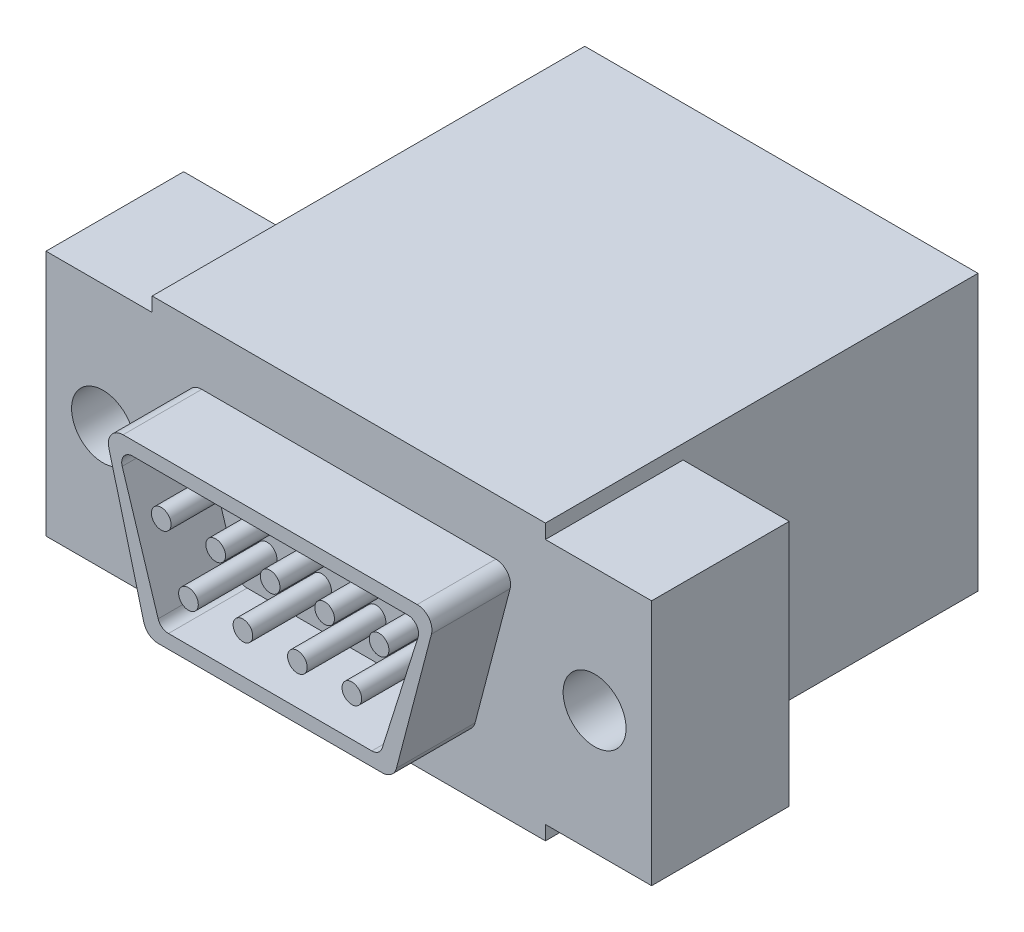
from build123d import *

# Parameters (mm, degrees)
SKETCH_1_W                                     = 30.8
SKETCH_1_H                                     = 12.55
M3_01_THINFLANGE_30_80X12_55X0_60_DEPTH        = 0.6
SKETCH_2_W                                     = 30.8
SKETCH_2_H                                     = 12.55
M3_02_FIRSTSHOULDER_30_80X12_55_D7_00_DEPTH    = 7
SKETCH_3_W                                     = 20
SKETCH_3_H                                     = 14
M3_03_SECONDSTAGECORE_20_00X14_00_D22_00_DEPTH = 22
SKETCH_4_R                                     = 2.5
M3_04_SIMPLIFIEDFIXEDPOSTS_DIA5_00_L3_50_DEPTH = 3.5
M3_05_ROUNDEDDGUIDE_OUTERBOSS_L4_00_DEPTH      = 4
M3_06_ROUNDEDDGUIDE_INNEROPENING_DEPTH         = 4
SKETCH_7_R                                     = 0.5
M3_07_9PINS_DIA1_00_L4_00_DEPTH                = 4
SKETCH_8_R                                     = 1.6
M3_08_FIXEDPOSTBORES_DIA3_20_PITCH25_00_DEPTH  = 4


with BuildPart() as part:
    # 草图1 → M3_01_ThinFlange_30.80x12.55x0.60 (new body)
    with BuildSketch(Plane.XY):
        Rectangle(SKETCH_1_W, SKETCH_1_H)
    extrude(amount=-M3_01_THINFLANGE_30_80X12_55X0_60_DEPTH)

    # 草图2 → M3_02_FirstShoulder_30.80x12.55_D7.00 (add)
    with BuildSketch(Plane.XY):
        Rectangle(SKETCH_2_W, SKETCH_2_H)
    extrude(amount=-M3_02_FIRSTSHOULDER_30_80X12_55_D7_00_DEPTH)

    # 草图3 → M3_03_SecondStageCore_20.00x14.00_D22.00_FromFlange (add)
    with BuildSketch(Plane.XY):
        Rectangle(SKETCH_3_W, SKETCH_3_H)
    extrude(amount=-M3_03_SECONDSTAGECORE_20_00X14_00_D22_00_DEPTH)

    # 草图4 → M3_04_SimplifiedFixedPosts_Dia5.00_L3.50 (add)
    with BuildSketch(Plane.XY):
        with Locations((-12.5, 0)):
            Circle(SKETCH_4_R)
        with Locations((12.5, 0)):
            Circle(SKETCH_4_R)
    extrude(amount=-M3_04_SIMPLIFIEDFIXEDPOSTS_DIA5_00_L3_50_DEPTH)

    # 草图5 → M3_05_RoundedDGuide_OuterBoss_L4.00 (add)
    with BuildSketch(Plane.XY):
        with BuildLine():
            Line((-7.478140403, 4.15), (7.478140403, 4.15))
            ThreePointArc((7.478140403, 4.15), (8.071894431, 3.858209727), (8.20364406, 3.209883078))
            Line((8.20364406, 3.209883078), (6.421716349, -3.590116922))
            ThreePointArc((6.421716349, -3.590116922), (6.154422419, -3.993754028), (5.696212692, -4.15))
            Line((5.696212692, -4.15), (-5.696212692, -4.15))
            ThreePointArc((-5.696212692, -4.15), (-6.154422419, -3.993754028), (-6.421716349, -3.590116922))
            Line((-6.421716349, -3.590116922), (-8.20364406, 3.209883078))
            ThreePointArc((-8.20364406, 3.209883078), (-8.071894431, 3.858209727), (-7.478140403, 4.15))
        make_face()
    extrude(amount=M3_05_ROUNDEDDGUIDE_OUTERBOSS_L4_00_DEPTH)

    # 草图6 → M3_06_RoundedDGuide_InnerOpening (cut)
    with BuildSketch(Plane.XY):
        with BuildLine():
            Line((-6.999952877, 3.45), (6.999952877, 3.45))
            ThreePointArc((6.999952877, 3.45), (7.443485369, 3.225236726), (7.524509443, 2.734650647))
            Line((7.524509443, 2.734650647), (5.696248574, -3.065349353))
            ThreePointArc((5.696248574, -3.065349353), (5.496928733, -3.343532493), (5.171692007, -3.45))
            Line((5.171692007, -3.45), (-5.171692007, -3.45))
            ThreePointArc((-5.171692007, -3.45), (-5.496928733, -3.343532493), (-5.696248574, -3.065349353))
            Line((-5.696248574, -3.065349353), (-7.524509443, 2.734650647))
            ThreePointArc((-7.524509443, 2.734650647), (-7.443485369, 3.225236726), (-6.999952877, 3.45))
        make_face()
    extrude(amount=M3_06_ROUNDEDDGUIDE_INNEROPENING_DEPTH, mode=Mode.SUBTRACT)

    # 草图7 → M3_07_9Pins_Dia1.00_L4.00 (add)
    with BuildSketch(Plane.XY):
        with Locations(Location((-5.54, 1.42, 0), (0, 0, 180))):
            Circle(SKETCH_7_R)
        with Locations(Location((-2.77, 1.42, 0), (0, 0, 180))):
            Circle(SKETCH_7_R)
        with Locations(Location((0, 1.42, 0), (0, 0, 180))):
            Circle(SKETCH_7_R)
        with Locations(Location((2.77, 1.42, 0), (0, 0, 180))):
            Circle(SKETCH_7_R)
        with Locations(Location((5.54, 1.42, 0), (0, 0, 180))):
            Circle(SKETCH_7_R)
        with Locations(Location((-4.155, -1.42, 0), (0, 0, 180))):
            Circle(SKETCH_7_R)
        with Locations(Location((-1.385, -1.42, 0), (0, 0, 180))):
            Circle(SKETCH_7_R)
        with Locations(Location((1.385, -1.42, 0), (0, 0, 180))):
            Circle(SKETCH_7_R)
        with Locations(Location((4.155, -1.42, 0), (0, 0, 180))):
            Circle(SKETCH_7_R)
    extrude(amount=M3_07_9PINS_DIA1_00_L4_00_DEPTH)

    # 草图8 → M3_08_FixedPostBores_Dia3.20_Pitch25.00 (cut)
    with BuildSketch(Plane.XY):
        with Locations((-12.5, 0)):
            Circle(SKETCH_8_R)
        with Locations((12.5, 0)):
            Circle(SKETCH_8_R)
    extrude(amount=-M3_08_FIXEDPOSTBORES_DIA3_20_PITCH25_00_DEPTH, mode=Mode.SUBTRACT)


solid = part.part
